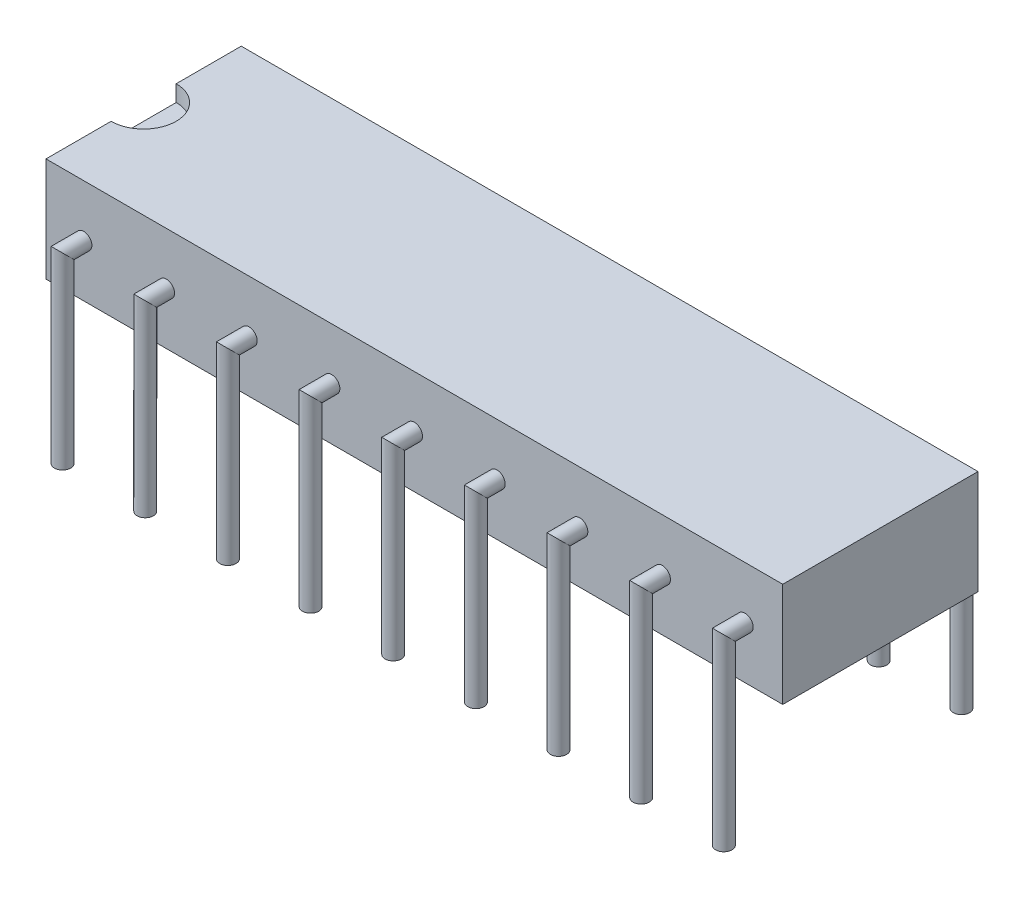
from build123d import *

# Parameters (mm, degrees)
ESQUISSE1_W                          = 6
ESQUISSE1_H                          = 3.2
EXTRUSION1_DEPTH                     = 22.64
ENL_V_MAT_EXTRU_1_DEPTH              = 0.5
ESQUISSE3_R                          = 0.25
R_P_TITION_LIN_AIRE1_COUNT           = 9
R_P_TITION_LIN_AIRE1_PITCH           = 2.54
R_P_TITION_LIN_AIRE1_COPY_1_SKETCH_R = 0.25
R_P_TITION_LIN_AIRE1_COPY_2_SKETCH_R = 0.25
R_P_TITION_LIN_AIRE1_COPY_3_SKETCH_R = 0.25
R_P_TITION_LIN_AIRE1_COPY_4_SKETCH_R = 0.25
R_P_TITION_LIN_AIRE1_COPY_5_SKETCH_R = 0.25
R_P_TITION_LIN_AIRE1_COPY_6_SKETCH_R = 0.25
R_P_TITION_LIN_AIRE1_COPY_7_SKETCH_R = 0.25
R_P_TITION_LIN_AIRE1_COPY_8_SKETCH_R = 0.25


with BuildPart() as part:
    # Esquisse1 → Extrusion1 (new body)
    with BuildSketch(Plane(origin=(0, 0, 0), x_dir=(0, 0, -1), z_dir=(1, 0, 0))):
        with Locations((0, 1.6)):
            Rectangle(ESQUISSE1_W, ESQUISSE1_H)
    extrude(amount=EXTRUSION1_DEPTH)

    # Esquisse2 → Enlèv. mat.-Extru.1 (cut)
    with BuildSketch(Plane(origin=(0, 3.2, 0), x_dir=(-1, 0, 0), z_dir=(0, 1, 0))):
        with BuildLine():
            Line((0, -1), (0, 1))
            ThreePointArc((0, 1), (-1, 0), (0, -1))
        make_face()
    extrude(amount=-ENL_V_MAT_EXTRU_1_DEPTH, mode=Mode.SUBTRACT)

    # Balayage1: sweep along a path in Esquisse5
    with BuildLine(Plane(origin=(1.16, 0, 0), x_dir=(0, 0, -1), z_dir=(1, 0, 0))) as balayage1_path:
        Line((-3, 1.6), (-3.65, 1.6))
        Line((-3.65, 1.6), (-3.65, -4))
    # Esquisse3 → Balayage1 (sweep)
    with BuildSketch(Plane.XY.offset(3)):
        with Locations((1.16, 1.6)):
            Circle(ESQUISSE3_R)
    balayage1 = sweep(path=balayage1_path.line, transition=Transition.RIGHT)

    # Symétrie1: Balayage1 across plane
    add(balayage1.mirror(Plane.XY))

    # Répétition linéaire1: Balayage1 ×9
    with Locations(*[(i * R_P_TITION_LIN_AIRE1_PITCH, 0, 0) for i in range(1, R_P_TITION_LIN_AIRE1_COUNT)]):
        add(balayage1)

    # Répétition linéaire1 copy 1: sweep along a path in Répétition linéaire1 copy 1 path
    with BuildLine(Plane(origin=(3.7, 0, 0), x_dir=(0, 0, 1), z_dir=(1, 0, 0))) as r_p_tition_lin_aire1_copy_1_path:
        Line((-3, -1.6), (-3.65, -1.6))
        Line((-3.65, -1.6), (-3.65, 4))
    # Répétition linéaire1 copy 1 sketch → Répétition linéaire1 copy 1 (sweep)
    with BuildSketch(Plane(origin=(2.54, 0, -3), x_dir=(1, 0, 0), z_dir=(0, 0, -1))):
        with Locations((1.16, -1.6)):
            Circle(R_P_TITION_LIN_AIRE1_COPY_1_SKETCH_R)
    sweep(path=r_p_tition_lin_aire1_copy_1_path.line, transition=Transition.RIGHT)

    # Répétition linéaire1 copy 2: sweep along a path in Répétition linéaire1 copy 2 path
    with BuildLine(Plane(origin=(6.24, 0, 0), x_dir=(0, 0, 1), z_dir=(1, 0, 0))) as r_p_tition_lin_aire1_copy_2_path:
        Line((-3, -1.6), (-3.65, -1.6))
        Line((-3.65, -1.6), (-3.65, 4))
    # Répétition linéaire1 copy 2 sketch → Répétition linéaire1 copy 2 (sweep)
    with BuildSketch(Plane(origin=(5.08, 0, -3), x_dir=(1, 0, 0), z_dir=(0, 0, -1))):
        with Locations((1.16, -1.6)):
            Circle(R_P_TITION_LIN_AIRE1_COPY_2_SKETCH_R)
    sweep(path=r_p_tition_lin_aire1_copy_2_path.line, transition=Transition.RIGHT)

    # Répétition linéaire1 copy 3: sweep along a path in Répétition linéaire1 copy 3 path
    with BuildLine(Plane(origin=(8.78, 0, 0), x_dir=(0, 0, 1), z_dir=(1, 0, 0))) as r_p_tition_lin_aire1_copy_3_path:
        Line((-3, -1.6), (-3.65, -1.6))
        Line((-3.65, -1.6), (-3.65, 4))
    # Répétition linéaire1 copy 3 sketch → Répétition linéaire1 copy 3 (sweep)
    with BuildSketch(Plane(origin=(7.62, 0, -3), x_dir=(1, 0, 0), z_dir=(0, 0, -1))):
        with Locations((1.16, -1.6)):
            Circle(R_P_TITION_LIN_AIRE1_COPY_3_SKETCH_R)
    sweep(path=r_p_tition_lin_aire1_copy_3_path.line, transition=Transition.RIGHT)

    # Répétition linéaire1 copy 4: sweep along a path in Répétition linéaire1 copy 4 path
    with BuildLine(Plane(origin=(11.32, 0, 0), x_dir=(0, 0, 1), z_dir=(1, 0, 0))) as r_p_tition_lin_aire1_copy_4_path:
        Line((-3, -1.6), (-3.65, -1.6))
        Line((-3.65, -1.6), (-3.65, 4))
    # Répétition linéaire1 copy 4 sketch → Répétition linéaire1 copy 4 (sweep)
    with BuildSketch(Plane(origin=(10.16, 0, -3), x_dir=(1, 0, 0), z_dir=(0, 0, -1))):
        with Locations((1.16, -1.6)):
            Circle(R_P_TITION_LIN_AIRE1_COPY_4_SKETCH_R)
    sweep(path=r_p_tition_lin_aire1_copy_4_path.line, transition=Transition.RIGHT)

    # Répétition linéaire1 copy 5: sweep along a path in Répétition linéaire1 copy 5 path
    with BuildLine(Plane(origin=(13.86, 0, 0), x_dir=(0, 0, 1), z_dir=(1, 0, 0))) as r_p_tition_lin_aire1_copy_5_path:
        Line((-3, -1.6), (-3.65, -1.6))
        Line((-3.65, -1.6), (-3.65, 4))
    # Répétition linéaire1 copy 5 sketch → Répétition linéaire1 copy 5 (sweep)
    with BuildSketch(Plane(origin=(12.7, 0, -3), x_dir=(1, 0, 0), z_dir=(0, 0, -1))):
        with Locations((1.16, -1.6)):
            Circle(R_P_TITION_LIN_AIRE1_COPY_5_SKETCH_R)
    sweep(path=r_p_tition_lin_aire1_copy_5_path.line, transition=Transition.RIGHT)

    # Répétition linéaire1 copy 6: sweep along a path in Répétition linéaire1 copy 6 path
    with BuildLine(Plane(origin=(16.4, 0, 0), x_dir=(0, 0, 1), z_dir=(1, 0, 0))) as r_p_tition_lin_aire1_copy_6_path:
        Line((-3, -1.6), (-3.65, -1.6))
        Line((-3.65, -1.6), (-3.65, 4))
    # Répétition linéaire1 copy 6 sketch → Répétition linéaire1 copy 6 (sweep)
    with BuildSketch(Plane(origin=(15.24, 0, -3), x_dir=(1, 0, 0), z_dir=(0, 0, -1))):
        with Locations((1.16, -1.6)):
            Circle(R_P_TITION_LIN_AIRE1_COPY_6_SKETCH_R)
    sweep(path=r_p_tition_lin_aire1_copy_6_path.line, transition=Transition.RIGHT)

    # Répétition linéaire1 copy 7: sweep along a path in Répétition linéaire1 copy 7 path
    with BuildLine(Plane(origin=(18.94, 0, 0), x_dir=(0, 0, 1), z_dir=(1, 0, 0))) as r_p_tition_lin_aire1_copy_7_path:
        Line((-3, -1.6), (-3.65, -1.6))
        Line((-3.65, -1.6), (-3.65, 4))
    # Répétition linéaire1 copy 7 sketch → Répétition linéaire1 copy 7 (sweep)
    with BuildSketch(Plane(origin=(17.78, 0, -3), x_dir=(1, 0, 0), z_dir=(0, 0, -1))):
        with Locations((1.16, -1.6)):
            Circle(R_P_TITION_LIN_AIRE1_COPY_7_SKETCH_R)
    sweep(path=r_p_tition_lin_aire1_copy_7_path.line, transition=Transition.RIGHT)

    # Répétition linéaire1 copy 8: sweep along a path in Répétition linéaire1 copy 8 path
    with BuildLine(Plane(origin=(21.48, 0, 0), x_dir=(0, 0, 1), z_dir=(1, 0, 0))) as r_p_tition_lin_aire1_copy_8_path:
        Line((-3, -1.6), (-3.65, -1.6))
        Line((-3.65, -1.6), (-3.65, 4))
    # Répétition linéaire1 copy 8 sketch → Répétition linéaire1 copy 8 (sweep)
    with BuildSketch(Plane(origin=(20.32, 0, -3), x_dir=(1, 0, 0), z_dir=(0, 0, -1))):
        with Locations((1.16, -1.6)):
            Circle(R_P_TITION_LIN_AIRE1_COPY_8_SKETCH_R)
    sweep(path=r_p_tition_lin_aire1_copy_8_path.line, transition=Transition.RIGHT)


solid = part.part
